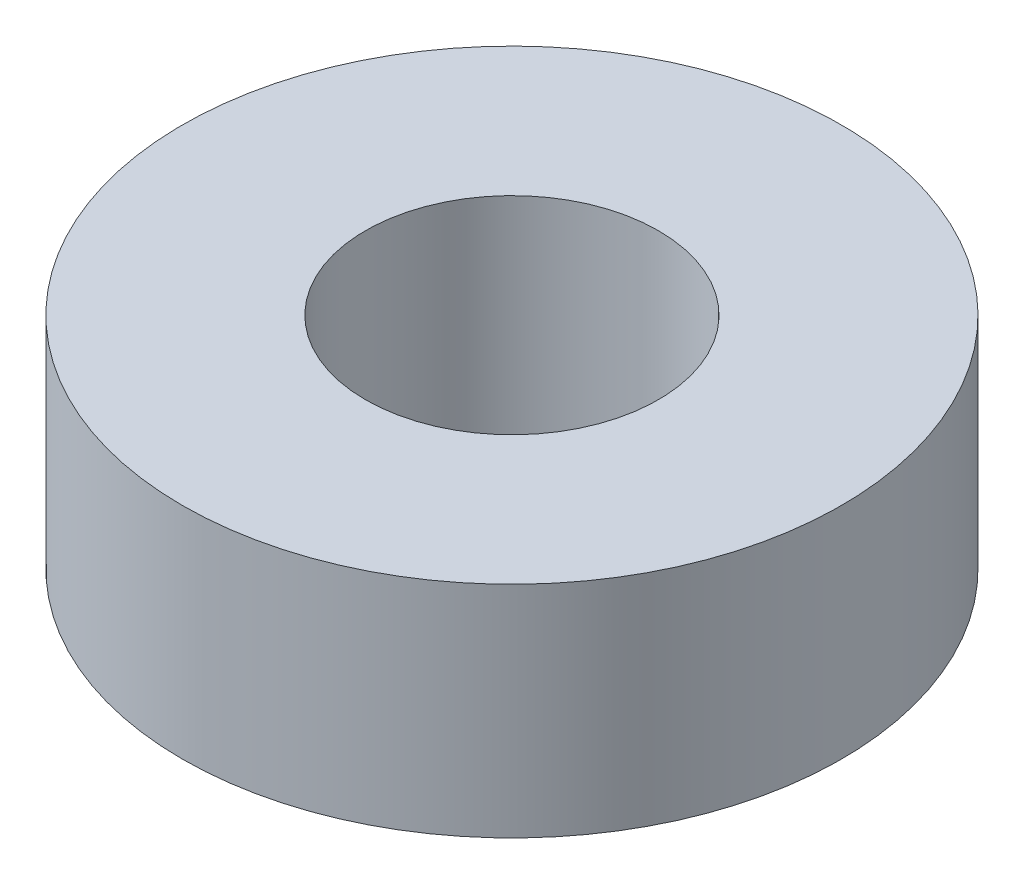
from build123d import *

# Parameters (mm, degrees)
SKIZZE1_R                       = 3.6
SKIZZE1_R_2                     = 1.6
AUFSATZ_LINEAR_AUSTRAGEN1_DEPTH = 2.4


with BuildPart() as part:
    # Skizze1 → Aufsatz-Linear austragen1 (new body)
    with BuildSketch(Plane(origin=(0, 0, 0), x_dir=(1, 0, 0), z_dir=(0, 1, 0))):
        with Locations(Location((0, 0, 0), (0, 0, 270))):
            Circle(SKIZZE1_R)
        with Locations(Location((0, 0, 0), (0, 0, 270))):
            Circle(SKIZZE1_R_2, mode=Mode.SUBTRACT)
    extrude(amount=AUFSATZ_LINEAR_AUSTRAGEN1_DEPTH)


solid = part.part
